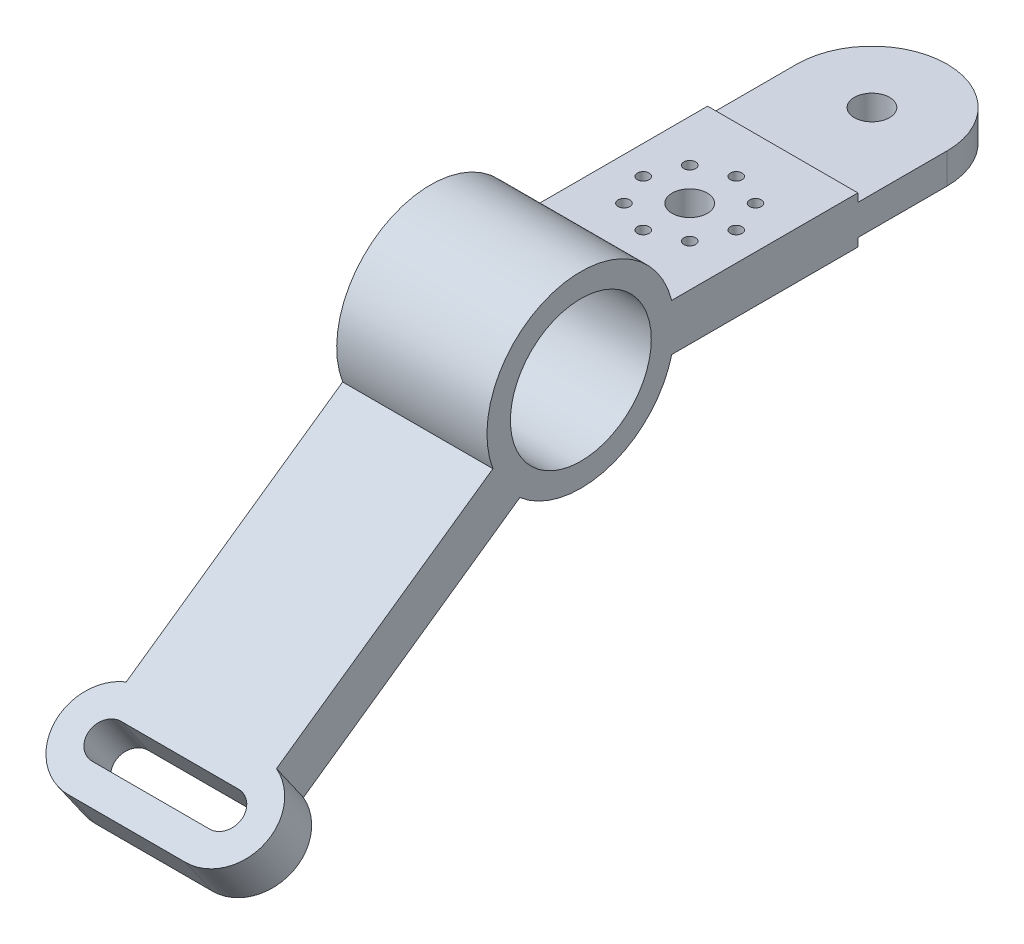
from build123d import *

# Parameters (mm, degrees)
SKETCH1_R           = 30
BOSS_EXTRUDE1_DEPTH = 32
CUT_EXTRUDE1_DEPTH  = 64
BOSS_EXTRUDE2_DEPTH = 20
SKETCH4_R           = 7.5
SKETCH4_R_2         = 2.5
CUT_EXTRUDE2_DEPTH  = 64
CIRPATTERN1_COUNT   = 8
BOSS_EXTRUDE3_DEPTH = 13
SKETCH6_R           = 7.5
CUT_EXTRUDE3_DEPTH  = 64


with BuildPart() as part:
    # Sketch1 → Boss-Extrude1 (new, symmetric)
    with BuildSketch(Plane(origin=(0, 0, 0), x_dir=(0, 0, -1), z_dir=(1, 0, 0))):
        with BuildLine():
            Line((0, 0), (11.471528727, -16.383040886))
            Line((11.471528727, -16.383040886), (119.001754001, 58.910433436))
            ThreePointArc((119.001754001, 58.910433436), (157.019843873, 51.167795707), (183.721445355, 79.316473737))
            Line((183.721445355, 79.316473737), (262.991611893, 79.316473737))
            Line((262.991611893, 79.316473737), (262.991611893, 82.816473737))
            Line((262.991611893, 82.816473737), (300.991611893, 82.816473737))
            Line((300.991611893, 82.816473737), (300.991611893, 95.816473737))
            Line((300.991611893, 95.816473737), (262.991611893, 95.816473737))
            Line((262.991611893, 95.816473737), (262.991611893, 99.316473737))
            Line((262.991611893, 99.316473737), (183.721445355, 99.316473737))
            ThreePointArc((183.721445355, 99.316473737), (132.963379912, 127.465151767), (107.530225274, 75.293474322))
            Line((107.530225274, 75.293474322), (0, 0))
        make_face()
        with Locations((144.991611893, 89.316473737)):
            Circle(SKETCH1_R, mode=Mode.SUBTRACT)
    extrude(amount=BOSS_EXTRUDE1_DEPTH, both=True)

    # Sketch2 → Cut-Extrude1 (cut)
    with BuildSketch(Plane(origin=(0, 0, 0), x_dir=(1, 0, 0), z_dir=(0, 0.8191520442889949, 0.5735764363510418))):
        with BuildLine():
            Line((25, -20), (-25, -20))
            ThreePointArc((-25, -20), (-45, 0), (-25, 20))
            Line((-25, 20), (25, 20))
            ThreePointArc((25, 20), (45, 0), (25, -20))
        make_face()
    extrude(amount=-CUT_EXTRUDE1_DEPTH, mode=Mode.SUBTRACT)

    # Sketch3 → Boss-Extrude2 (add)
    with BuildSketch(Plane(origin=(0, 0, 0), x_dir=(1, 0, 0), z_dir=(0, 0.8191520442889949, 0.5735764363510418))):
        with BuildLine():
            Line((25, -20), (-25, -20))
            ThreePointArc((-25, -20), (-45, 0), (-25, 20))
            Line((-25, 20), (25, 20))
            ThreePointArc((25, 20), (45, 0), (25, -20))
        make_face()
        with BuildLine():
            Line((25, -7.5), (-25, -7.5))
            ThreePointArc((-25, -7.5), (-32.5, 0), (-25, 7.5))
            Line((-25, 7.5), (25, 7.5))
            ThreePointArc((25, 7.5), (32.5, 0), (25, -7.5))
        make_face(mode=Mode.SUBTRACT)
    extrude(amount=-BOSS_EXTRUDE2_DEPTH)

    # Sketch4 → Cut-Extrude2 (cut)
    with BuildSketch(Plane(origin=(0, 99.316473737, 0), x_dir=(1, 0, 0), z_dir=(0, 1, 0))):
        with Locations(Location((0, 223.371445355, 0), (0, 0, 270))):
            Circle(SKETCH4_R)
        with Locations(Location((0, 243.181528624, 0), (0, 0, 270))):
            Circle(SKETCH4_R_2)
    cut_extrude2 = extrude(amount=-CUT_EXTRUDE2_DEPTH, mode=Mode.SUBTRACT)

    # CirPattern1: Cut-Extrude2 ×8 about axis
    cirpattern1_axis = Axis((0, 0, -223.371445355), (0, 1, 0))
    for i in range(1, CIRPATTERN1_COUNT):
        add(cut_extrude2.rotate(cirpattern1_axis, i * 360 / CIRPATTERN1_COUNT), mode=Mode.SUBTRACT)

    # Sketch5 → Boss-Extrude3 (add)
    with BuildSketch(Plane(origin=(0, 95.816473737, 0), x_dir=(1, 0, 0), z_dir=(0, 1, 0))):
        with BuildLine():
            Line((-32, 300.991611893), (32, 300.991611893))
            ThreePointArc((32, 300.991611893), (0, 332.991611893), (-32, 300.991611893))
        make_face()
    extrude(amount=-BOSS_EXTRUDE3_DEPTH)

    # Sketch6 → Cut-Extrude3 (cut)
    with BuildSketch(Plane(origin=(0, 95.816473737, 0), x_dir=(1, 0, 0), z_dir=(0, 1, 0))):
        with Locations(Location((0, 300.991611893, 0), (0, 0, 270))):
            Circle(SKETCH6_R)
    extrude(amount=-CUT_EXTRUDE3_DEPTH, mode=Mode.SUBTRACT)


solid = part.part
